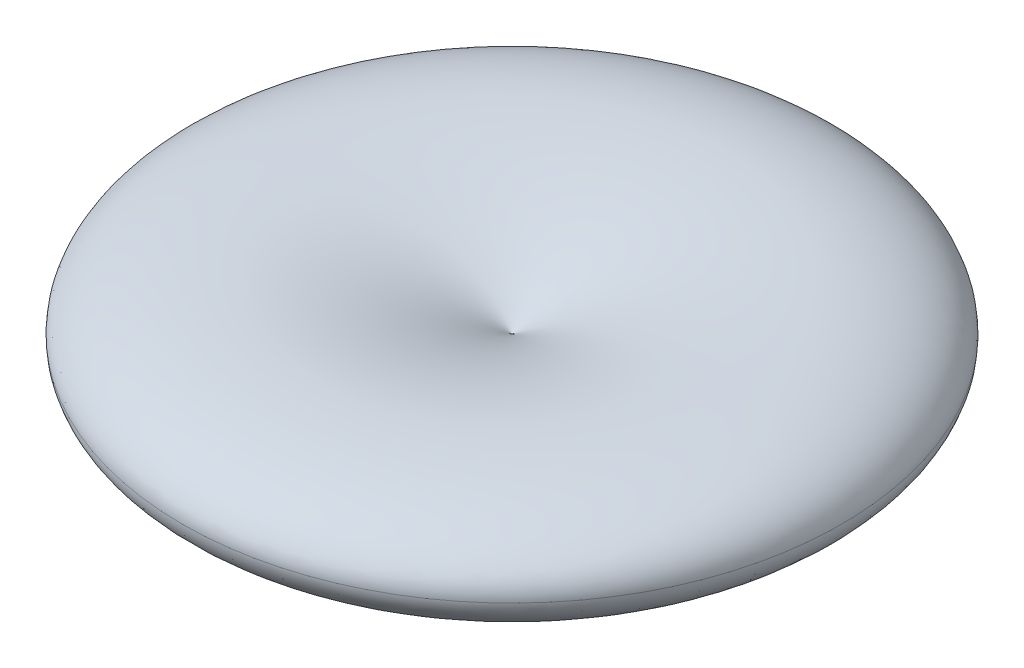
from build123d import *


with BuildPart() as part:
    # Sketch → Revolve 2 (revolve)
    with BuildSketch(Plane.XY):
        with BuildLine():
            add(Edge.make_bspline(
                [(99.471839432, 0), (99.471839432, -0.070462214), (99.469893476, -0.211493591), (99.462596123, -0.408875719), (99.446578414, -0.635651828), (99.424795149, -0.858561984), (99.385743267, -1.172717226), (99.309209135, -1.617228744), (99.168563786, -2.191809815), (98.947868654, -2.853209096), (98.654744051, -3.543554809), (98.28185563, -4.255471979), (97.805895635, -5.01109229), (97.216058209, -5.797012978), (96.502372403, -6.609164611), (95.658146182, -7.433341811), (94.62116345, -8.312283495), (93.377312031, -9.219109073), (91.585793912, -10.344437052), (88.48048356, -11.939076986), (83.945436603, -13.641861503), (77.937072372, -15.127382932), (70.923574942, -16.113103535), (63.754639968, -16.518410443), (56.576476238, -16.418944424), (49.419421792, -15.873379235), (42.30562397, -14.920600217), (35.253828025, -13.585869012), (28.281738354, -11.883482655), (21.40842098, -9.817747288), (15.501205501, -7.685580568), (10.534942613, -5.610395613), (6.649737182, -3.776016403), (4.112593069, -2.462217602), (2.250663578, -1.412655337), (1.038055864, -0.678588564), (0.44040738, -0.29757278), (0.145790194, -0.100692877), (0, 0)],
                knots=[0.057033761, 0.057033761, 0.057033761, 0.057033761, 0.057033761, 0.059619689, 0.062205618, 0.063498582, 0.064791546, 0.067377474, 0.073216916, 0.079056359, 0.085262423, 0.091468488, 0.099151397, 0.106834306, 0.116135436, 0.125436566, 0.136531239, 0.147625912, 0.163141943, 0.178657973, 0.209689725, 0.268250034, 0.330313709, 0.392377368, 0.454440962, 0.516504647, 0.578568252, 0.640631908, 0.702695554, 0.764759226, 0.826822895, 0.888886342, 0.919918121, 0.950949901, 0.97547495, 0.987737475, 0.993868738, 1, 1, 1, 1, 1], degree=4))
            add(Edge.make_bspline(
                [(0, 0), (0.145358986, 0.100261937), (0.43885482, 0.296647328), (1.034517126, 0.676317583), (2.242884062, 1.408095917), (4.098967628, 2.454766443), (6.628490307, 3.765392902), (10.502644945, 5.595926642), (15.455376041, 7.667551489), (21.346440137, 9.796843356), (28.200908037, 11.861053975), (35.153890911, 13.563762987), (42.186410646, 14.9008277), (49.28093045, 15.858230234), (56.41883218, 16.411093837), (63.578346601, 16.521197344), (70.729438446, 16.130803047), (77.76258574, 15.1609352), (83.794169118, 13.68854928), (88.777455522, 11.837131197), (92.171854468, 10.035372899), (94.189860525, 8.667717788), (95.580125552, 7.504060151), (96.437362525, 6.677312683), (97.162817696, 5.862452894), (97.695164001, 5.162120269), (98.088883928, 4.562824027), (98.401699043, 4.024610991), (98.666631967, 3.508818842), (98.920647673, 2.92374475), (99.119390345, 2.345410499), (99.253470568, 1.846812549), (99.354046152, 1.367928255), (99.414625378, 0.976418464), (99.45336011, 0.595682837), (99.468504415, 0.260668694), (99.471596326, 0.100376854), (99.471839432, 0.014447348), (99.471839432, 0)],
                knots=[0, 0, 0, 0, 0, 0.006110467, 0.012220934, 0.024441868, 0.048883736, 0.079835681, 0.110787626, 0.172691386, 0.234595364, 0.296499343, 0.358403167, 0.420307027, 0.482210921, 0.544114747, 0.606018652, 0.667922603, 0.729826327, 0.789465205, 0.820416994, 0.851368903, 0.862509091, 0.873649278, 0.883100096, 0.892550914, 0.900224581, 0.904061415, 0.907898248, 0.914088433, 0.920278618, 0.926115337, 0.929033697, 0.931952056, 0.937194042, 0.939815035, 0.942436028, 0.942966239, 0.942966239, 0.942966239, 0.942966239, 0.942966239], degree=4))
        make_face()
    revolve(axis=Axis((-0.006476993, -1000.049597382, 0), (0, 1, 0)))


solid = part.part
